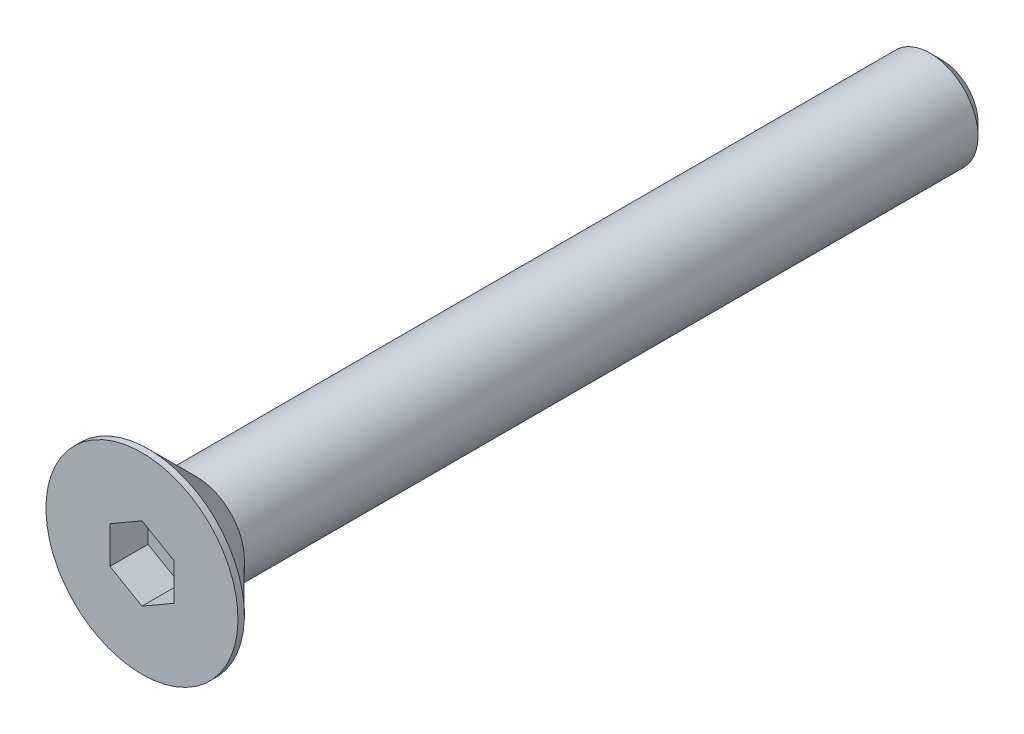
from build123d import *

# Parameters (mm, degrees)
SKETCH1_W          = 25
SKETCH1_H          = 1.5
CHAMFER1_SIZE      = 0.375
CUT_EXTRUDE2_DEPTH = 1.19


with BuildPart() as part:
    # Sketch1 → Revolve1 (revolve)
    with BuildSketch(Plane(origin=(0, 0, 0), x_dir=(0, 0, -1), z_dir=(1, 0, 0))):
        with Locations((12.5, 0.75)):
            Rectangle(SKETCH1_W, SKETCH1_H)
    revolve(axis=Axis((0, 0, -25), (0, 0, 1)))

    # Chamfer1
    chamfer1_edges = [part.edges().sort_by_distance(p)[0] for p in [
        (0, -1.5, -25),
    ]]
    chamfer(chamfer1_edges, length=CHAMFER1_SIZE)

    # Sketch7 → Revolve2 (revolve)
    with BuildSketch(Plane(origin=(0, 0, 0), x_dir=(0, 0, -1), z_dir=(1, 0, 0)), mode=Mode.PRIVATE) as revolve2_sk:
        Polygon((0, 3), (0.2, 3), (1.7, 1.5), (1.7, 0), (0, 0), align=None)
    revolve(revolve2_sk.sketch.rotate(Axis((0, 0, 0), (0, 0, -1)), 180), axis=Axis((0, 0, 0), (0, 0, -1)))

    # Boss-Extrude1 cone 1 section (through the dimple's axis) → Boss-Extrude1 (revolve)
    with BuildSketch(Plane(origin=(0, 0, -1.7), x_dir=(0, -1, 0), z_dir=(1, 0, 0))):
        Polygon((0, 0), (1.5, 0), (0, 1.5), align=None)
    revolve(axis=Axis((0, 0, -1.7), (0, 0, -1)))

    # Sketch5 → Cut-Extrude2 (cut)
    with BuildSketch(Plane.XY):
        Polygon((1, -0.577350269), (1, 0.577350269), (0, 1.154700538), (-1, 0.577350269), (-1, -0.577350269), (0, -1.154700538), align=None)
    extrude(amount=-CUT_EXTRUDE2_DEPTH, mode=Mode.SUBTRACT)


solid = part.part
